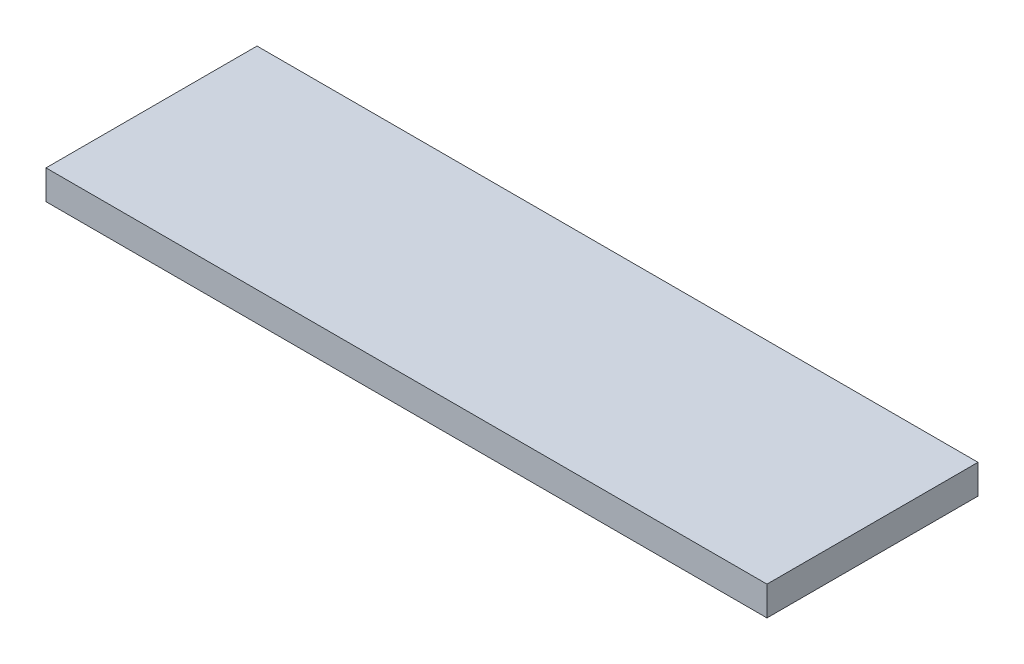
from build123d import *

# Parameters (mm, degrees)
SKETCH_1_W      = 246
SKETCH_1_H      = 72
EXTRUDE_1_DEPTH = 10


with BuildPart() as part:
    # 草图1 → 凸台-拉伸1 (new body)
    with BuildSketch(Plane(origin=(0, 0, 0), x_dir=(1, 0, 0), z_dir=(0, 1, 0))):
        with Locations((123, -36)):
            Rectangle(SKETCH_1_W, SKETCH_1_H)
    extrude(amount=EXTRUDE_1_DEPTH)


solid = part.part
